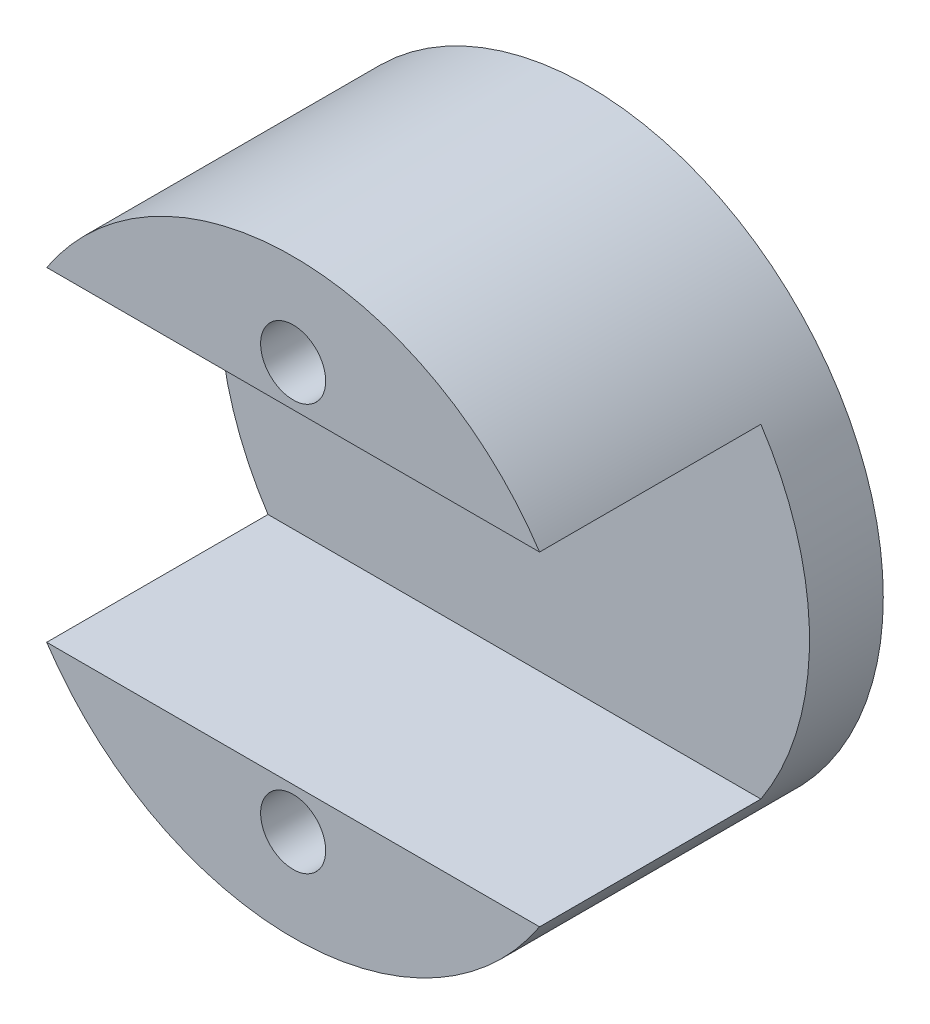
from build123d import *

# Parameters (mm, degrees)
SKETCH1_R           = 25.4
BOSS_EXTRUDE1_DEPTH = 25.4
CUT_EXTRUDE1_DEPTH  = 19.05
SKETCH3_R           = 2.8
CUT_EXTRUDE2_DEPTH  = 44.994090512


with BuildPart() as part:
    # Sketch1 → Boss-Extrude1 (new body)
    with BuildSketch(Plane.XY):
        Circle(SKETCH1_R)
    extrude(amount=BOSS_EXTRUDE1_DEPTH)

    # Sketch2 → Cut-Extrude1 (cut)
    with BuildSketch(Plane.XY.offset(25.4)):
        with BuildLine():
            Line((-21.945834457, 13.97), (21.945834457, 13.97))
            ThreePointArc((21.945834457, 13.97), (26.015006247, 0), (21.945834457, -13.97))
            Line((21.945834457, -13.97), (-21.945834457, -13.97))
            ThreePointArc((-21.945834457, -13.97), (-26.015006247, 0), (-21.945834457, 13.97))
        make_face()
    extrude(amount=-CUT_EXTRUDE1_DEPTH, mode=Mode.SUBTRACT)

    # Sketch3 → Cut-Extrude2 (cut, through all)
    with BuildSketch(Plane.XY.offset(25.4)):
        with Locations((0, 17.5)):
            Circle(SKETCH3_R)
        with Locations((0, -17.5)):
            Circle(SKETCH3_R)
    extrude(amount=-CUT_EXTRUDE2_DEPTH, mode=Mode.SUBTRACT)


solid = part.part
